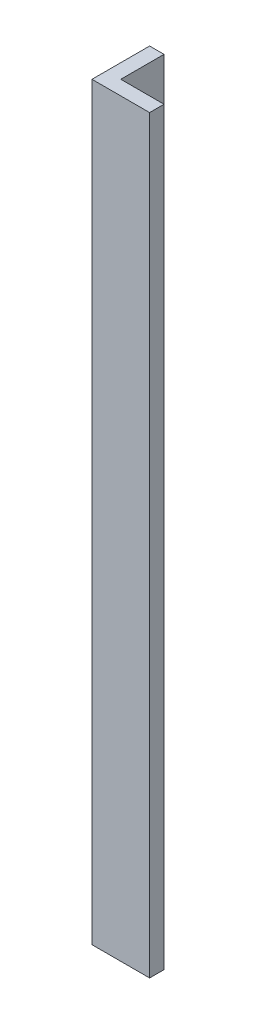
from build123d import *

# Parameters (mm, degrees)
BOSS_EXTRUDE1_DEPTH = 260


with BuildPart() as part:
    # Sketch1 → Boss-Extrude1 (new body)
    with BuildSketch(Plane(origin=(0, 0, 0), x_dir=(1, 0, 0), z_dir=(0, 1, 0))):
        Polygon((-11.903225806, 9.35483871), (-16.903225806, 9.35483871), (-16.903225806, -4.64516129), (-16.903225806, -10.64516129), (-8.580645161, -10.64516129), (3.096774194, -10.64516129), (3.096774194, -5.64516129), (-11.903225806, -5.64516129), align=None)
    extrude(amount=BOSS_EXTRUDE1_DEPTH)


solid = part.part
